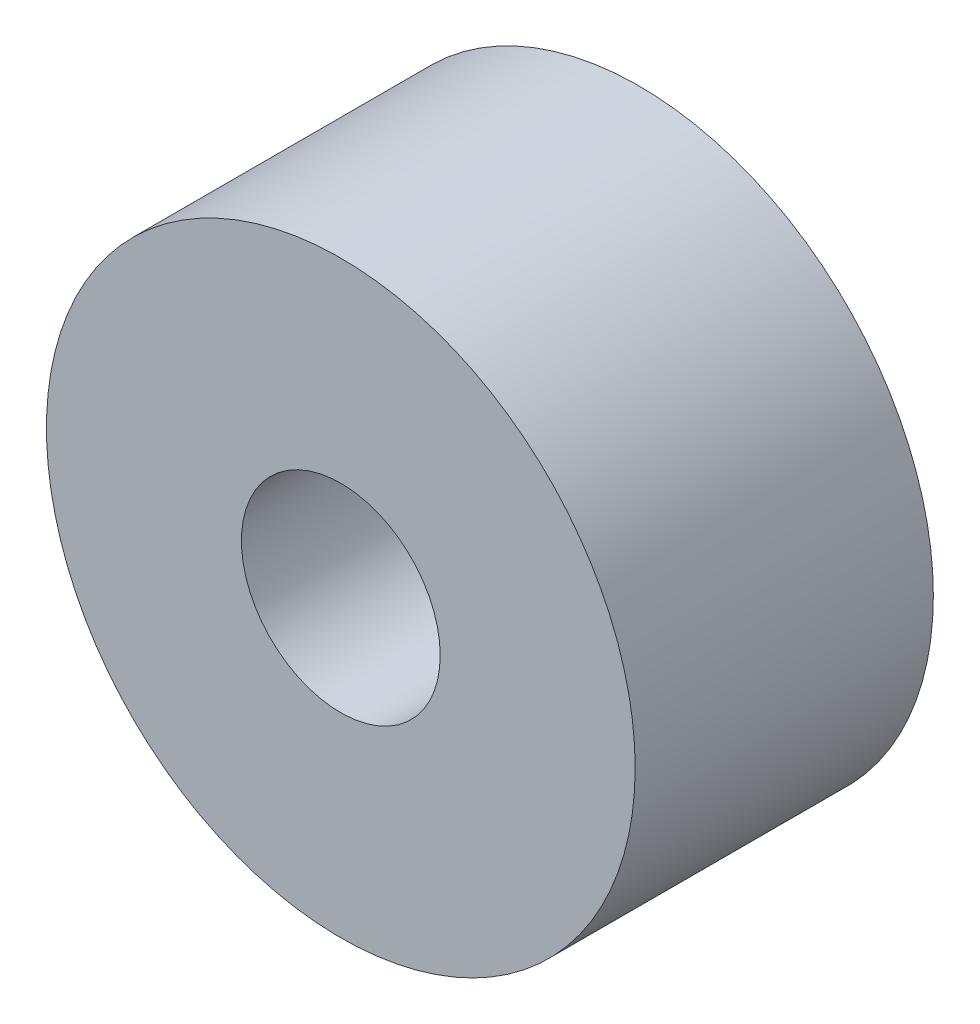
from build123d import *

# Parameters (mm, degrees)
CARRIER_START = -15
SKETCH_1_R    = 29.615384615
SKETCH_1_R_2  = 10
CARRIER_DEPTH = 30


with BuildPart() as part:
    # Эскиз1 → Carrier (new body)
    with BuildSketch(Plane.XY.offset(CARRIER_START)):
        Circle(SKETCH_1_R)
        Circle(SKETCH_1_R_2, mode=Mode.SUBTRACT)
    extrude(amount=CARRIER_DEPTH)


solid = part.part
